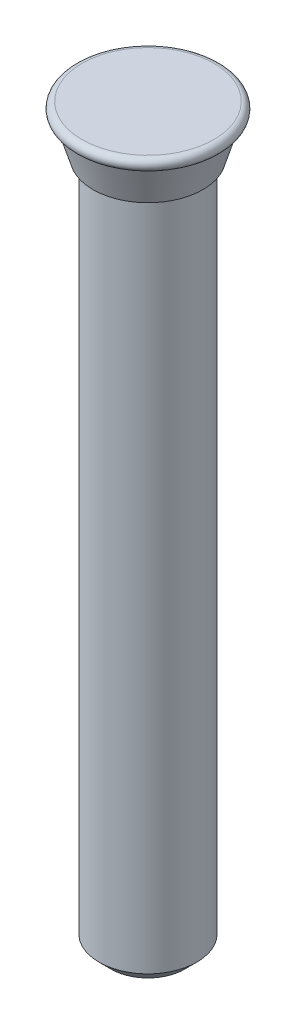
from build123d import *


with BuildPart() as part:
    # Sketch1 → Revolve1 (revolve)
    with BuildSketch(Plane(origin=(0, 0, 0), x_dir=(-1, 0, 0), z_dir=(0, 0, -1)), mode=Mode.PRIVATE) as revolve1_sk:
        with BuildLine():
            Line((-1.5, -30), (0, -30))
            Line((0, -30), (0, 0))
            Line((0, 0), (-2.7, 0))
            ThreePointArc((-2.7, 0), (-2.95, -0.25), (-2.7, -0.5))
            Line((-2.7, -0.5), (-2.25, -2))
            Line((-2.25, -2), (-2, -2))
            Line((-2, -2), (-2, -29.5))
            Line((-2, -29.5), (-1.5, -30))
        make_face()
    revolve(revolve1_sk.sketch.rotate(Axis((0, -30, 0), (0, 1, 0)), 270), axis=Axis((0, -30, 0), (0, 1, 0)))


solid = part.part
